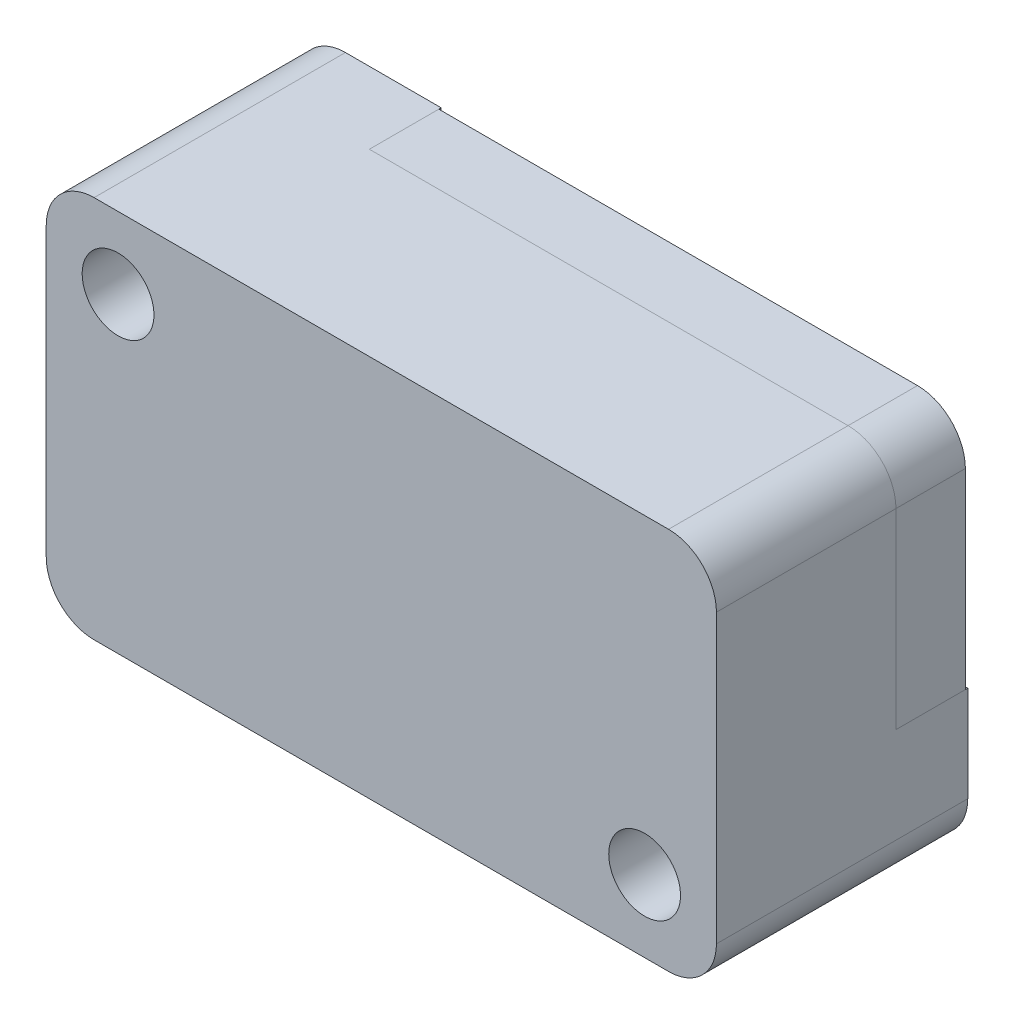
from build123d import *

# Parameters (mm, degrees)
SKETCH1_W           = 28
SKETCH1_H           = 16
SKETCH1_R           = 1.5
BOSS_EXTRUDE1_DEPTH = 10.5
FILLET1_R           = 2
CUT_EXTRUDE1_START  = -3
CUT_EXTRUDE1_DEPTH  = 3
BOSS_EXTRUDE2_DEPTH = 2.9


with BuildPart() as part:
    # Sketch1 → Boss-Extrude1 (new body)
    with BuildSketch(Plane.XY):
        Rectangle(SKETCH1_W, SKETCH1_H)
        with Locations(Location((-11, 5, 0), (0, 0, 180))):
            Circle(SKETCH1_R, mode=Mode.SUBTRACT)
        with Locations(Location((11, -5, 0), (0, 0, 180))):
            Circle(SKETCH1_R, mode=Mode.SUBTRACT)
    extrude(amount=BOSS_EXTRUDE1_DEPTH)

    # Fillet1
    fillet1_edges = [part.edges().sort_by_distance(p)[0] for p in [
        (14, -8, 5.25),
        (-14, -8, 5.25),
        (-14, 8, 5.25),
        (14, 8, 5.25),
    ]]
    fillet(fillet1_edges, radius=FILLET1_R)

    # Sketch3 → Cut-Extrude1 (cut)
    with BuildSketch(Plane(origin=(0, 0, 0), x_dir=(-1, 0, 0), z_dir=(0, 0, -1)).offset(CUT_EXTRUDE1_START)):
        with BuildLine():
            Line((-14, -2), (-10, -2))
            ThreePointArc((-10, -2), (-8.585786438, -2.585786438), (-8, -4))
            Line((-8, -4), (-8, -8))
            Line((-8, -8), (12, -8))
            ThreePointArc((12, -8), (13.414213562, -7.414213562), (14, -6))
            Line((14, -6), (14, 2))
            Line((14, 2), (10, 2))
            ThreePointArc((10, 2), (8.585786438, 2.585786438), (8, 4))
            Line((8, 4), (8, 8))
            Line((8, 8), (-12, 8))
            ThreePointArc((-12, 8), (-13.414213562, 7.414213562), (-14, 6))
            Line((-14, 6), (-14, -2))
        make_face()
    extrude(amount=CUT_EXTRUDE1_DEPTH, mode=Mode.SUBTRACT)


with BuildPart() as body_2:
    # Sketch5 → Boss-Extrude2 (new body)
    with BuildSketch(Plane(origin=(0, 0, 3), x_dir=(-1, 0, 0), z_dir=(0, 0, -1))):
        with BuildLine():
            Line((-14, 6), (-14, -2))
            Line((-14, -2), (-10, -2))
            ThreePointArc((-10, -2), (-8.585786438, -2.585786438), (-8, -4))
            Line((-8, -4), (-8, -8))
            Line((-8, -8), (12, -8))
            ThreePointArc((12, -8), (13.414213562, -7.414213562), (14, -6))
            Line((14, -6), (14, 2))
            Line((14, 2), (10, 2))
            ThreePointArc((10, 2), (8.585786438, 2.585786438), (8, 4))
            Line((8, 4), (8, 8))
            Line((8, 8), (-12, 8))
            ThreePointArc((-12, 8), (-13.414213562, 7.414213562), (-14, 6))
        make_face()
    extrude(amount=BOSS_EXTRUDE2_DEPTH)


solid = Compound([part.part, body_2.part])
